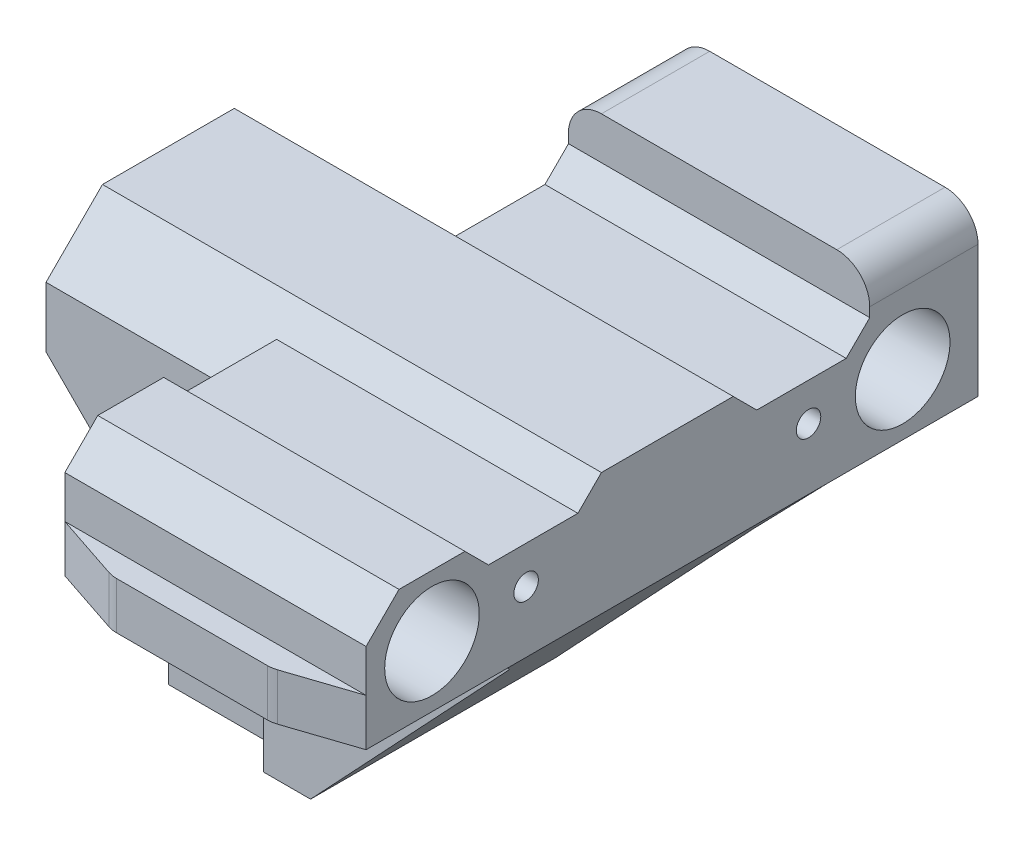
from build123d import *

# Parameters (mm, degrees)
SKETCH_1_W               = 43
SKETCH_1_H               = 39.5
EXTRUDE_1_DEPTH          = 10
SKETCH_2_W               = 43
SKETCH_2_H               = 13
EXTRUDE_2_DEPTH          = 32
SKETCH_3_R               = 2.75
CUT_EXTRUDE_4_DEPTH      = 58.123222073
CHAMFER_1_SIZE           = 3.5
CUT_EXTRUDE_3_DEPTH      = 44.316422983
CUT_EXTRUDE_3_DEPTH_BACK = 44.316422983
SKETCH_6_R               = 1.3
EXTRUDE_3_DEPTH          = 3
SKETCH_9_W               = 19
SKETCH_9_H               = 13
CUT_EXTRUDE_6_DEPTH      = 11
CUT_EXTRUDE_7_DEPTH      = 54.640586313
CHAMFER_2_SIZE           = 6
CUT_EXTRUDE_START        = -32
SKETCH_12_R              = 5.025
CUT_EXTRUDE_10_DEPTH     = 28.1
EXTRUDE_4_DEPTH          = 10
CHAMFER_5_SIZE           = 10
CUT_EXTRUDE_11_DEPTH     = 50.376740476
CHAMFER_7_SIZE           = 4
SKETCH_15_R              = 1.3
CUT_EXTRUDE_12_DEPTH     = 10
SKETCH_21_W              = 32
SKETCH_21_H              = 4.5
EXTRUDE_7_DEPTH          = 10.5
SKETCH_21_3_R            = 1.3
CUT_EXTRUDE_15_DEPTH     = 6
FILLET_2_R               = 3.5
SKETCH_22_R              = 1.3
EXTRUDE_8_DEPTH          = 1
EXTRUDE_9_DEPTH          = 5
FILLET_3_R               = 3


with BuildPart() as part:
    # 草图1 → 凸台-拉伸1 (new, symmetric)
    with BuildSketch(Plane.XY):
        Rectangle(SKETCH_1_W, SKETCH_1_H)
    extrude(amount=EXTRUDE_1_DEPTH, both=True)

    # 草图2 → 凸台-拉伸2 (add, symmetric)
    with BuildSketch(Plane.XY):
        with Locations((0, 13.25)):
            Rectangle(SKETCH_2_W, SKETCH_2_H)
    extrude(amount=EXTRUDE_2_DEPTH, both=True)

    # 草图3 → 切除-拉伸4 (cut, through all)
    with BuildSketch(Plane.ZY.offset(21.5)):
        with Locations((-25, 13.25)):
            Circle(SKETCH_3_R)
        with Locations((25, 13.25)):
            Circle(SKETCH_3_R)
    extrude(amount=-CUT_EXTRUDE_4_DEPTH, mode=Mode.SUBTRACT)

    # 倒角1
    chamfer_1_edges = [part.edges().sort_by_distance(p)[0] for p in [
        (0, 19.75, 32),
    ]]
    chamfer(chamfer_1_edges, length=CHAMFER_1_SIZE)

    # 草图6 → 切除-拉伸3 (cut, two sides: drawn at the far end of the back side and taken through both)
    with BuildSketch(Plane.XY.offset(-CUT_EXTRUDE_3_DEPTH_BACK)):
        with Locations((-18, -6.25)):
            Circle(SKETCH_6_R)
        with Locations((-18, -16.25)):
            Circle(SKETCH_6_R)
        with Locations((-12, -11.25)):
            Circle(SKETCH_6_R)
    extrude(amount=CUT_EXTRUDE_3_DEPTH + CUT_EXTRUDE_3_DEPTH_BACK, mode=Mode.SUBTRACT)

    # 草图7 → 凸台-拉伸3 (add)
    with BuildSketch(Plane.XY.offset(10)):
        Polygon((-21.5, -2.65), (-12.458578644, -2.65), (-8.4, -6.708578644), (-8.4, -19.75), (21.5, -19.75), (21.5, 6.75), (-21.5, 6.75), align=None)
    extrude_3 = extrude(amount=EXTRUDE_3_DEPTH)

    # 镜向3: 凸台-拉伸3 across plane
    add(extrude_3.mirror(Plane.XY))

    # 草图9 → 切除-拉伸6 (cut)
    with BuildSketch(Plane.ZY.offset(21.5)):
        with Locations((-22.5, 13.25)):
            Rectangle(SKETCH_9_W, SKETCH_9_H)
        with Locations((22.5, 13.25)):
            Rectangle(SKETCH_9_W, SKETCH_9_H)
    extrude(amount=-CUT_EXTRUDE_6_DEPTH, mode=Mode.SUBTRACT)

    # 草图10 → 切除-拉伸7 (cut, through all)
    with BuildSketch(Plane.XY.offset(13)):
        Polygon((-3.4, -19.75), (21.5, 6.75), (21.5, -19.75), align=None)
    extrude(amount=-CUT_EXTRUDE_7_DEPTH, mode=Mode.SUBTRACT)

    # 倒角2
    chamfer_2_edges = [part.edges().sort_by_distance(p)[0] for p in [
        (-16, 19.75, -13),
        (-16, 19.75, 13),
    ]]
    chamfer(chamfer_2_edges, length=CHAMFER_2_SIZE)

    # 草图12 → 切除-拉伸10 (cut)
    with BuildSketch(Plane.ZY.offset(10.5).offset(CUT_EXTRUDE_START)):
        with Locations((25, 13.25)):
            Circle(SKETCH_12_R)
        with Locations((-25, 13.25)):
            Circle(SKETCH_12_R)
    extrude(amount=CUT_EXTRUDE_10_DEPTH, mode=Mode.SUBTRACT)

    # 草图13 → 凸台-拉伸4 (add)
    with BuildSketch(Plane.ZY.offset(21.5)):
        Polygon((-13, -2.65), (-10, -2.65), (-10, 12.507359313), (-5.757359313, 16.75), (5.757359313, 16.75), (10, 12.507359313), (10, -2.65), (13, -2.65), (13, 13.75), (7, 19.75), (-7, 19.75), (-13, 13.75), align=None)
    extrude(amount=EXTRUDE_4_DEPTH)

    # 倒角5
    chamfer_5_edges = [part.edges().sort_by_distance(p)[0] for p in [
        (-31.5, -2.65, 11.5),
        (-31.5, -2.65, -11.5),
    ]]
    chamfer(chamfer_5_edges, length=CHAMFER_5_SIZE)

    # 草图14 → 切除-拉伸11 (cut, through all)
    with BuildSketch(Plane.ZY.offset(10.5)):
        Polygon((-21.5, 19.75), (-19, 17.25), (-9.5, 17.25), (-7, 19.75), align=None)
        Polygon((9.5, 17.25), (7, 19.75), (21.5, 19.75), (19, 17.25), align=None)
    extrude(amount=-CUT_EXTRUDE_11_DEPTH, mode=Mode.SUBTRACT)

    # 倒角7
    chamfer_7_edges = [part.edges().sort_by_distance(p)[0] for p in [
        (5.5, 6.75, 13),
        (5.5, 6.75, -13),
    ]]
    chamfer(chamfer_7_edges, length=CHAMFER_7_SIZE)

    # 草图15 → 切除-拉伸12 (cut)
    with BuildSketch(Plane(origin=(21.5, 0, 0), x_dir=(0, 0, -1), z_dir=(1, 0, 0))):
        with Locations((-15, 13.25)):
            Circle(SKETCH_15_R)
        with Locations((15, 13.25)):
            Circle(SKETCH_15_R)
    extrude(amount=-CUT_EXTRUDE_12_DEPTH, mode=Mode.SUBTRACT)

    # 草图21 → 凸台-拉伸7 (add)
    with BuildSketch(Plane(origin=(0, 0, -32), x_dir=(-1, 0, 0), z_dir=(0, 0, -1))):
        with Locations((-5.5, 22)):
            Rectangle(SKETCH_21_W, SKETCH_21_H)
    extrude(amount=-EXTRUDE_7_DEPTH)

    # 草图21<3> → 切除-拉伸15 (cut)
    with BuildSketch(Plane(origin=(0, 0, -32), x_dir=(-1, 0, 0), z_dir=(0, 0, -1))):
        with Locations((7, 20.75)):
            Circle(SKETCH_21_3_R)
        with Locations((-18, 20.75)):
            Circle(SKETCH_21_3_R)
    extrude(amount=-CUT_EXTRUDE_15_DEPTH, mode=Mode.SUBTRACT)

    # 圆角2
    fillet_2_edges = [part.edges().sort_by_distance(p)[0] for p in [
        (21.5, 24.25, -26.75),
        (-10.5, 24.25, -26.75),
    ]]
    fillet(fillet_2_edges, radius=FILLET_2_R)

    # 草图22 → 凸台-拉伸8 (add)
    with BuildSketch(Plane(origin=(0, 0, -32), x_dir=(-1, 0, 0), z_dir=(0, 0, -1))):
        with BuildLine():
            Line((10.5, 6.75), (10.5, 20.75))
            ThreePointArc((10.5, 20.75), (9.474873734, 23.224873734), (7, 24.25))
            Line((7, 24.25), (-18, 24.25))
            ThreePointArc((-18, 24.25), (-20.474873734, 23.224873734), (-21.5, 20.75))
            Line((-21.5, 20.75), (-21.5, 6.75))
            Line((-21.5, 6.75), (10.5, 6.75))
        make_face()
        with Locations((7, 20.75)):
            Circle(SKETCH_22_R, mode=Mode.SUBTRACT)
        with Locations((-18, 20.75)):
            Circle(SKETCH_22_R, mode=Mode.SUBTRACT)
    extrude(amount=EXTRUDE_8_DEPTH)

    # 草图24 → 凸台-拉伸9 (add)
    with BuildSketch(Plane.XZ.offset(-6.75)):
        Polygon((-10.5, 32), (-4.5, 34), (-3, 34.5), (14, 34.5), (15.5, 34), (21.5, 32), align=None)
    extrude(amount=-EXTRUDE_9_DEPTH)

    # 圆角3
    fillet_3_edges = [part.edges().sort_by_distance(p)[0] for p in [
        (-3, 9.25, 34.5),
        (14, 9.25, 34.5),
    ]]
    fillet(fillet_3_edges, radius=FILLET_3_R)


solid = part.part
